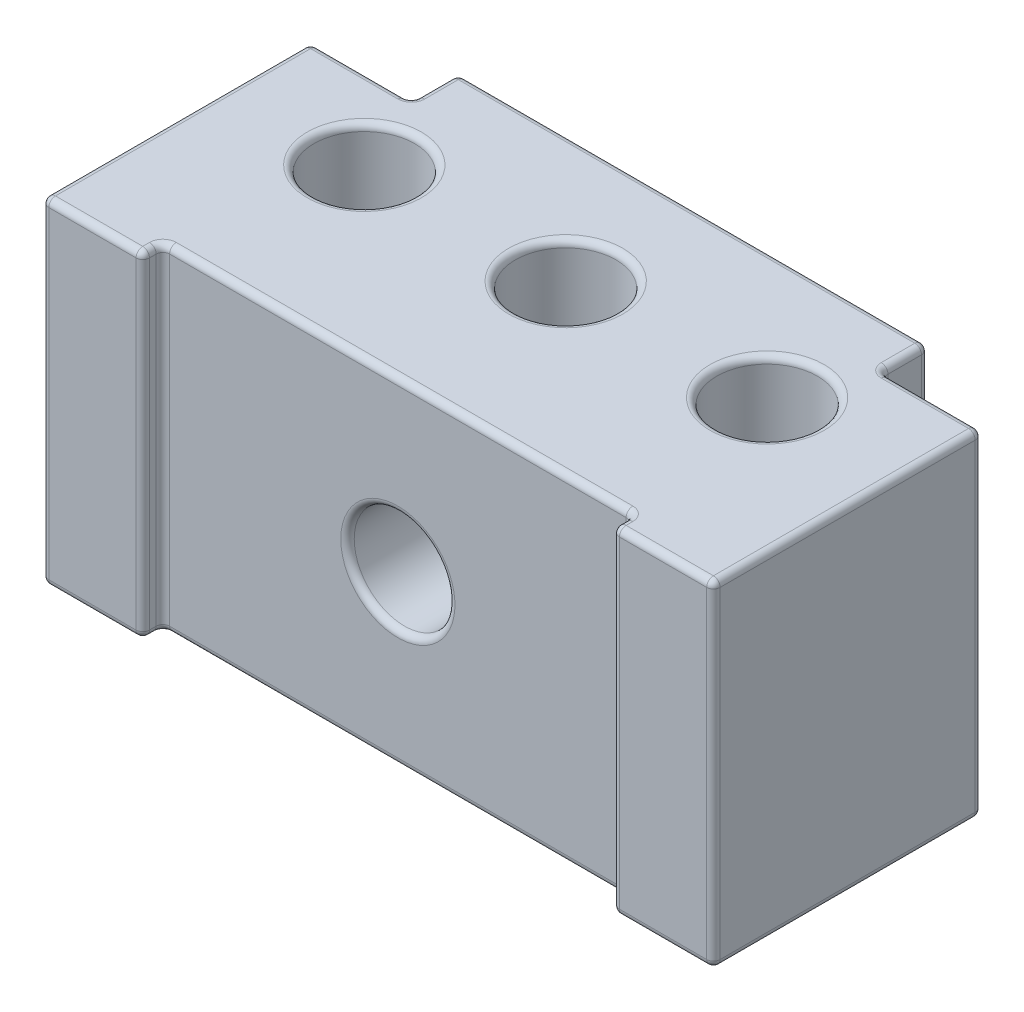
from build123d import *

# Parameters (mm, degrees)
BOSS_EXTRUDE2_DEPTH          = 100
SKETCH1_9_R                  = 15
CUT_EXTRUDE5_DEPTH           = 100
F_1_0_1_DIAMETER_HOLE1_D     = 30
F_1_0_1_DIAMETER_HOLE1_DEPTH = 50
F_1_0_1_DIAMETER_HOLE1_TIP   = 9.012909285
FILLET1_R                    = 2


with BuildPart() as part:
    # Sketch1 → Boss-Extrude2 (new body)
    with BuildSketch(Plane(origin=(0, 0, 0), x_dir=(1, 0, 0), z_dir=(0, 1, 0))):
        Polygon((0, 0), (30, 0), (30, 6), (170, 6), (170, 0), (200, 0), (200, 80), (170, 80), (170, 94), (30, 94), (30, 80), (0, 80), align=None)
    extrude(amount=BOSS_EXTRUDE2_DEPTH)

    # Sketch1<9> → Cut-Extrude5 (cut)
    with BuildSketch(Plane(origin=(0, 0, 0), x_dir=(1, 0, 0), z_dir=(0, 1, 0))):
        with Locations((40, 56)):
            Circle(SKETCH1_9_R)
        with Locations((100, 56)):
            Circle(SKETCH1_9_R)
        with Locations((160, 56)):
            Circle(SKETCH1_9_R)
    extrude(amount=CUT_EXTRUDE5_DEPTH, mode=Mode.SUBTRACT)

    # Ø1.0 (1) Diameter Hole1
    with Locations(Plane.XY.offset(-6)):
        with Locations((100, 50)):
            Hole(F_1_0_1_DIAMETER_HOLE1_D / 2, depth=F_1_0_1_DIAMETER_HOLE1_DEPTH)
            with Locations((0, 0, -(F_1_0_1_DIAMETER_HOLE1_DEPTH + F_1_0_1_DIAMETER_HOLE1_TIP / 2))):  # 118° drill point
                Cone(0, F_1_0_1_DIAMETER_HOLE1_D / 2, F_1_0_1_DIAMETER_HOLE1_TIP, mode=Mode.SUBTRACT)

    # Fillet1
    fillet1_edges = [part.edges().sort_by_distance(p)[0] for p in [
        (170, 50, 0),
        (30, 50, 0),
        (115, 50, -6),
        (30, 50, -6),
        (170, 50, -6),
        (170, 50, -94),
        (200, 50, 0),
        (25, 0, -56),
        (85, 0, -56),
        (145, 0, -56),
        (100, 0, -6),
        (170, 0, -3),
        (185, 0, 0),
        (200, 0, -40),
        (170, 0, -87),
        (100, 0, -94),
        (15, 0, 0),
        (30, 0, -3),
        (200, 50, -80),
        (170, 50, -80),
        (185, 0, -80),
        (30, 50, -94),
        (30, 0, -87),
        (15, 100, 0),
        (30, 100, -87),
        (100, 100, -94),
        (170, 100, -87),
        (185, 100, -80),
        (200, 100, -40),
        (185, 100, 0),
        (170, 100, -3),
        (100, 100, -6),
        (30, 100, -3),
        (25, 100, -56),
        (85, 100, -56),
        (145, 100, -56),
        (30, 50, -80),
        (15, 100, -80),
        (15, 0, -80),
        (0, 50, -80),
        (0, 100, -40),
        (0, 50, 0),
        (0, 0, -40),
    ]]
    fillet(fillet1_edges, radius=FILLET1_R)


solid = part.part
